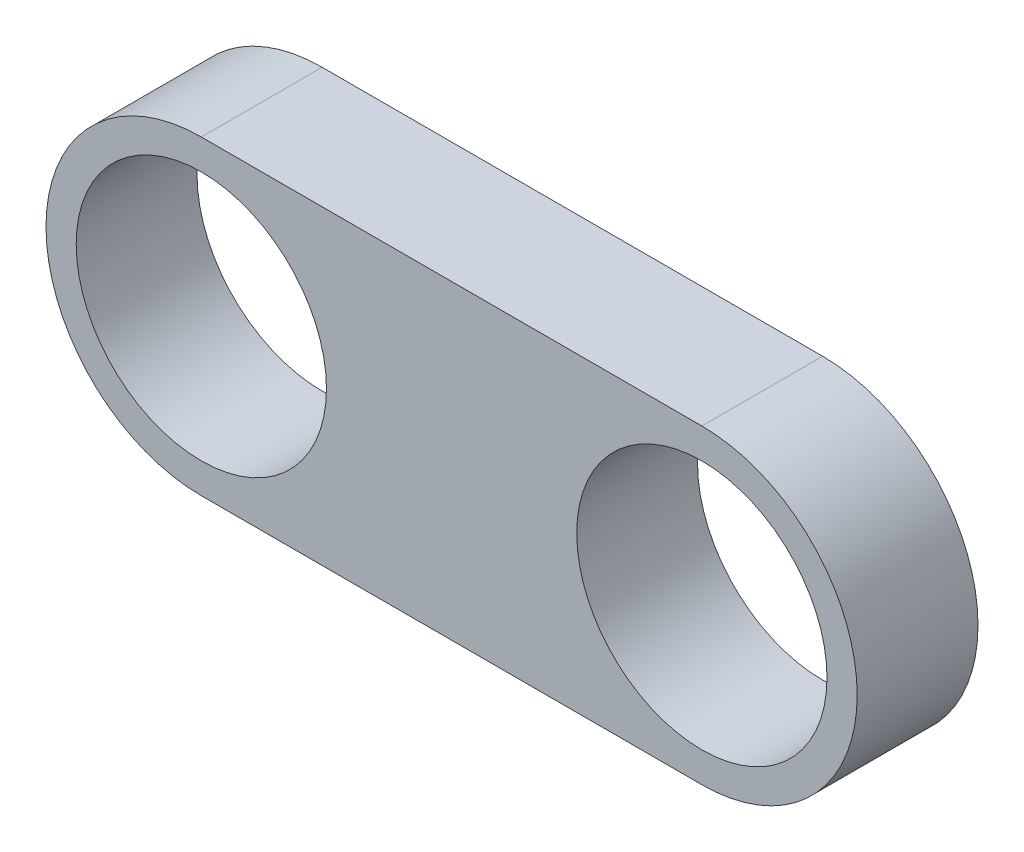
from build123d import *

# Parameters (mm, degrees)
EXTRUDE_1_DEPTH = 7
M16X1_51_D      = 14.5


with BuildPart() as part:
    # Эскиз1 → Бобышка-Вытянуть1 (new body)
    with BuildSketch(Plane.XY):
        with BuildLine():
            Line((14.5, 9), (-14.5, 9))
            ThreePointArc((-14.5, 9), (-23.5, 0), (-14.5, -9))
            Line((-14.5, -9), (14.5, -9))
            ThreePointArc((14.5, -9), (23.5, 0), (14.5, 9))
        make_face()
    extrude(amount=EXTRUDE_1_DEPTH)

    # Отверстие обработанное метчиком M16x1.51 (through all)
    with Locations(Plane(origin=(0, 0, 0), x_dir=(-1, 0, 0), z_dir=(0, 0, -1))):
        with Locations((14.5, 0)):
            m16x1_51 = Hole(M16X1_51_D / 2)

    # Зеркальное отражение1: Отверстие обработанное метчиком M16x1.51 across plane
    add(m16x1_51.mirror(Plane(origin=(0, 0, 0), x_dir=(0, 0, 1), z_dir=(1, 0, 0))), mode=Mode.SUBTRACT)


solid = part.part
